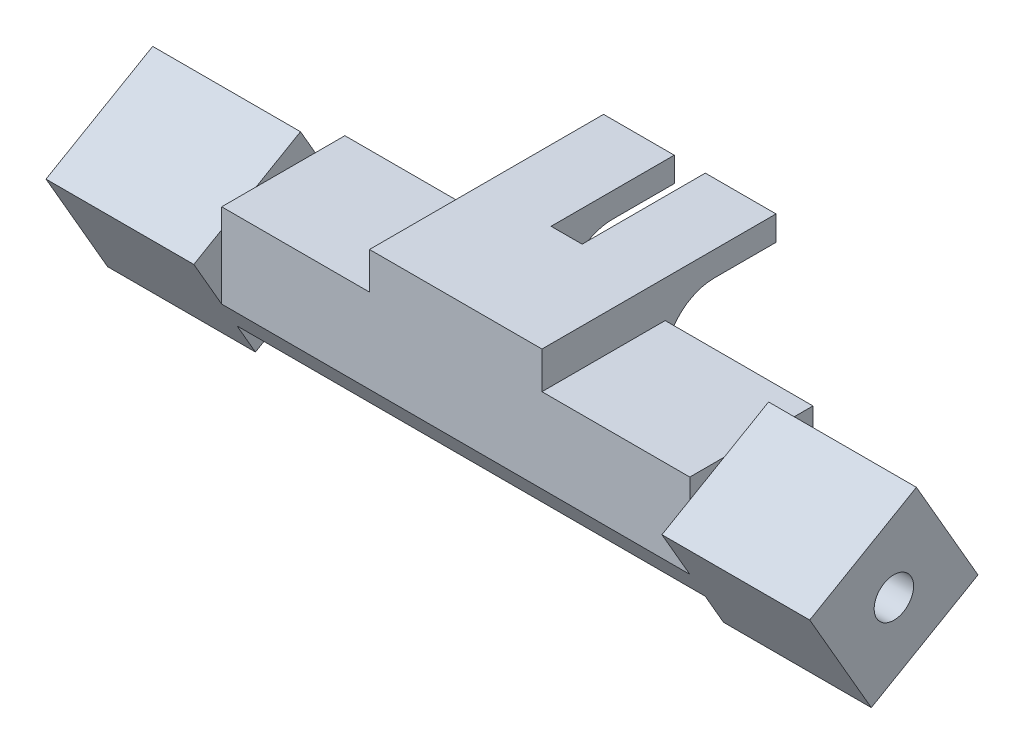
from build123d import *

# Parameters (mm, degrees)
SKETCH_1_W          = 7
SKETCH_1_H          = 4.5
EXTRUDE_1_DEPTH     = 1
SKETCH_1_3_W        = 7
SKETCH_1_3_H        = 5
EXTRUDE_2_DEPTH     = 4
FILLET2_R           = 2
SKETCH_2_W          = 19
SKETCH_2_H          = 5
EXTRUDE_3_DEPTH     = 2
SKETCH_2_4_W        = 19
SKETCH_2_4_H        = 5
EXTRUDE_4_DEPTH     = 2.5
SKETCH_11_W         = 1.26
SKETCH_11_H         = 5
CUT_EXTRUDE_4_DEPTH = 1.3
BOSS_EXTRUDE1_DEPTH = 6
BOSS_EXTRUDE2_DEPTH = 6
SKETCH5_R           = 0.8
CUT_EXTRUDE3_DEPTH  = 33.339752706
CUT_EXTRUDE8_DEPTH  = 27.643190595


with BuildPart() as part:
    # 草图1 → 凸台-拉伸1 (new body)
    with BuildSketch(Plane(origin=(0, 0, 0), x_dir=(1, 0, 0), z_dir=(0, 1, 0))):
        with Locations((0, 2.75)):
            Rectangle(SKETCH_1_W, SKETCH_1_H)
    extrude(amount=-EXTRUDE_1_DEPTH)

    # 草图1<3> → 凸台-拉伸2 (add)
    with BuildSketch(Plane(origin=(0, 0, 0), x_dir=(1, 0, 0), z_dir=(0, 1, 0))):
        with Locations((0, -2)):
            Rectangle(SKETCH_1_3_W, SKETCH_1_3_H)
    extrude(amount=-EXTRUDE_2_DEPTH)

    # Fillet2
    fillet2_edges = [part.edges().sort_by_distance(p)[0] for p in [
        (0, -1, -0.5),
    ]]
    fillet(fillet2_edges, radius=FILLET2_R)

    # 草图2 → 凸台-拉伸3 (add)
    with BuildSketch(Plane.XZ.offset(4)):
        with Locations((0, 2)):
            Rectangle(SKETCH_2_W, SKETCH_2_H)
    extrude(amount=EXTRUDE_3_DEPTH)

    # 草图2<4> → 凸台-拉伸4 (add)
    with BuildSketch(Plane.XZ.offset(4)):
        with Locations((0, 2)):
            Rectangle(SKETCH_2_4_W, SKETCH_2_4_H)
    extrude(amount=-EXTRUDE_4_DEPTH)

    # 草图11 → 切除-拉伸4 (cut)
    with BuildSketch(Plane(origin=(0, 0, 0), x_dir=(1, 0, 0), z_dir=(0, 1, 0))):
        with Locations((0, 2.5)):
            Rectangle(SKETCH_11_W, SKETCH_11_H)
    extrude(amount=-CUT_EXTRUDE_4_DEPTH, mode=Mode.SUBTRACT)

    # Sketch1 → Boss-Extrude1 (add)
    with BuildSketch(Plane.ZY.offset(9.5)):
        Polygon((-1.198557159, -4.790063509), (1.301442841, -0.459936491), (5.63156986, -2.959936491), (3.13156986, -7.290063509), align=None)
    extrude(amount=BOSS_EXTRUDE1_DEPTH)

    # Sketch2 → Boss-Extrude2 (add)
    with BuildSketch(Plane(origin=(9.5, 0, 0), x_dir=(0, 0, -1), z_dir=(1, 0, 0))):
        Polygon((-5.63156986, -2.959936491), (-1.301442841, -0.459936491), (1.198557159, -4.790063509), (-3.13156986, -7.290063509), align=None)
    extrude(amount=BOSS_EXTRUDE2_DEPTH)

    # Sketch5 → Cut-Extrude3 (cut, through all)
    with BuildSketch(Plane.ZY.offset(15.5)):
        with Locations((2.216506351, -3.875)):
            Circle(SKETCH5_R)
    extrude(amount=-CUT_EXTRUDE3_DEPTH, mode=Mode.SUBTRACT)

    # Sketch8 → Cut-Extrude8 (cut, through all)
    with BuildSketch(Plane.ZY.offset(9.5)):
        Polygon((-0.5, -5.193375673), (-0.5, -6), (0.897114317, -6), align=None)
        Polygon((4.5, -4.919872981), (3.876388375, -6), (4.5, -6), align=None)
    extrude(amount=-CUT_EXTRUDE8_DEPTH, mode=Mode.SUBTRACT)


solid = part.part
